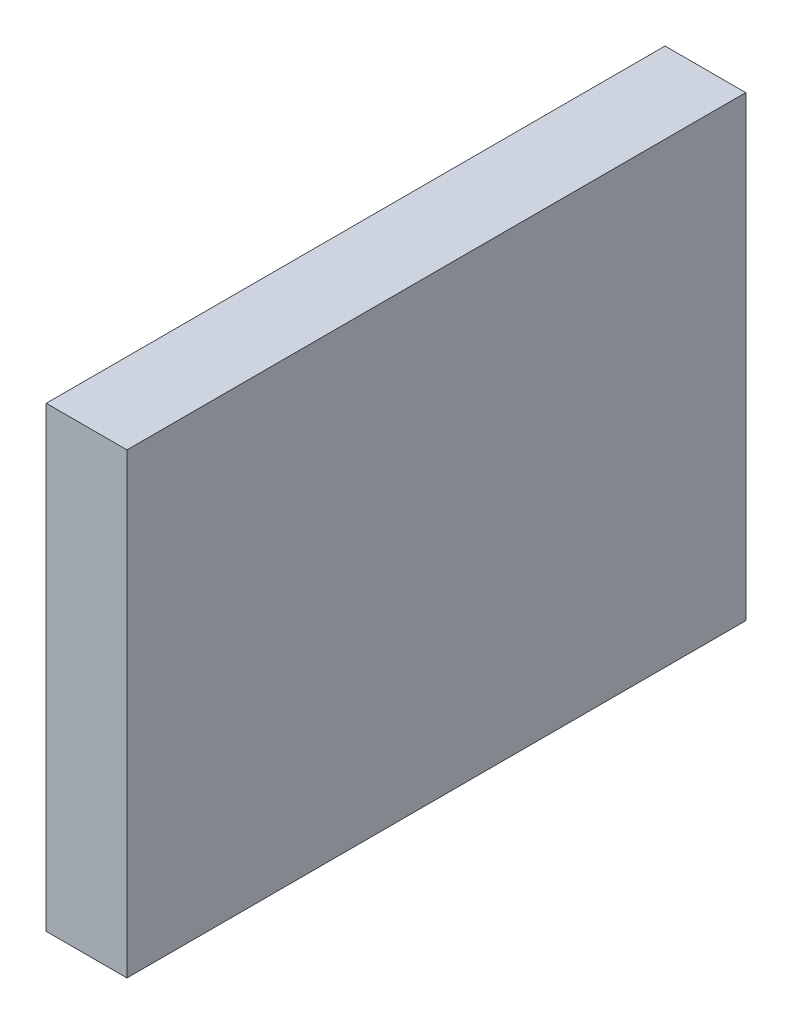
from build123d import *

# Parameters (mm, degrees)
SKETCH1_W           = 76.2
SKETCH1_H           = 431.8
BOSS_EXTRUDE1_DEPTH = 584.2


with BuildPart() as part:
    # Sketch1 → Boss-Extrude1 (new body)
    with BuildSketch(Plane.XY):
        Rectangle(SKETCH1_W, SKETCH1_H)
    extrude(amount=BOSS_EXTRUDE1_DEPTH)


solid = part.part
